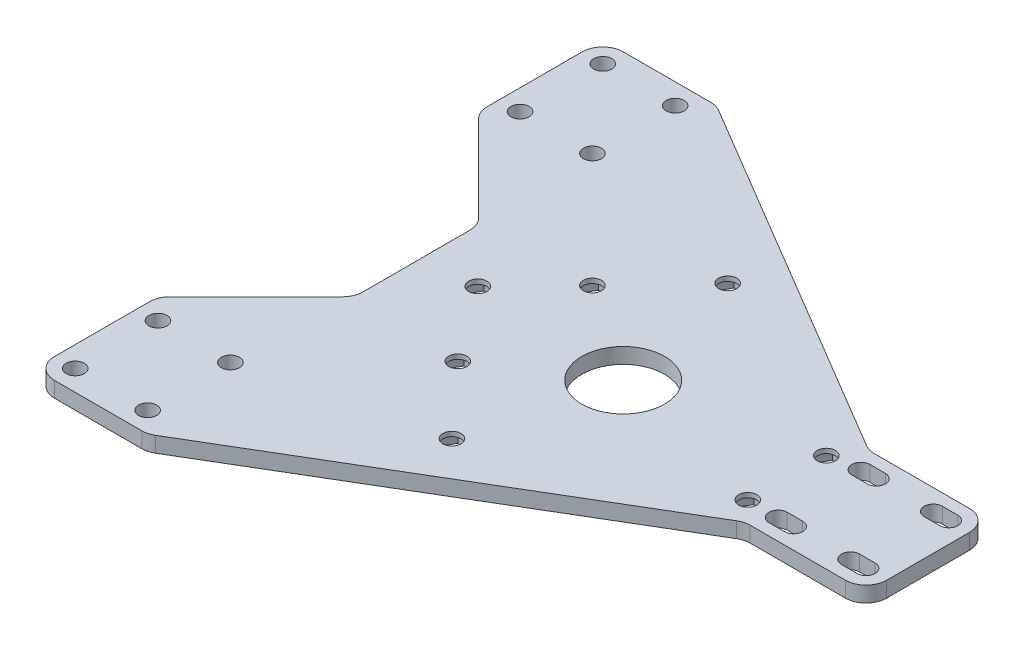
from build123d import *

# Parameters (mm, degrees)
ESQUISSE1_W             = 117.9
ESQUISSE1_H             = 110
BOSS_EXTRU_1_DEPTH      = 3
ESQUISSE2_R             = 1.75
ENL_V_MAT_EXTRU_1_DEPTH = 81.679009042
CONG_1_R                = 4
ESQUISSE3_R             = 8
ENL_V_MAT_EXTRU_2_DEPTH = 81.679009042
ENL_V_MAT_EXTRU_3_DEPTH = 2.1
ESQUISSE19_R            = 1.75
ENL_V_MAT_EXTRU_4_DEPTH = 81.679009042


with BuildPart() as part:
    # Esquisse1 → Boss.-Extru.1 (new body)
    with BuildSketch(Plane(origin=(0, 0, 0), x_dir=(1, 0, 0), z_dir=(0, 1, 0))):
        Rectangle(ESQUISSE1_W, ESQUISSE1_H)
    extrude(amount=BOSS_EXTRU_1_DEPTH)

    # Esquisse2 → Enlèv. mat.-Extru.1 (cut, through all)
    with BuildSketch(Plane(origin=(0, 0, 0), x_dir=(1, 0, 0), z_dir=(0, 1, 0))):
        with Locations(Location((-40.95, -35, 0), (0, 0, 270))):
            Circle(ESQUISSE2_R)
        with Locations(Location((-54.95, -35, 0), (0, 0, 270))):
            Circle(ESQUISSE2_R)
        with Locations(Location((-54.95, -51, 0), (0, 0, 270))):
            Circle(ESQUISSE2_R)
        with Locations(Location((-40.95, -51, 0), (0, 0, 270))):
            Circle(ESQUISSE2_R)
        with Locations(Location((-40.95, 51, 0), (0, 0, 90))):
            Circle(ESQUISSE2_R)
        with Locations(Location((-54.95, 51, 0), (0, 0, 90))):
            Circle(ESQUISSE2_R)
        with Locations(Location((-54.95, 35, 0), (0, 0, 90))):
            Circle(ESQUISSE2_R)
        with Locations(Location((-40.95, 35, 0), (0, 0, 90))):
            Circle(ESQUISSE2_R)
        Polygon((58.95, 12), (35.45, 12), (-36.95, 55), (58.95, 55), align=None)
        Polygon((58.95, -12), (35.45, -12), (-36.95, -55), (58.95, -55), align=None)
        Polygon((-58.95, -31), (-39.95, -12), (-39.95, 12), (-58.95, 31), align=None)
        with BuildLine():
            Line((37.95, 9.75), (40.95, 9.75))
            ThreePointArc((40.95, 9.75), (42.7, 8), (40.95, 6.25))
            Line((40.95, 6.25), (37.95, 6.25))
            ThreePointArc((37.95, 6.25), (36.2, 8), (37.95, 9.75))
        make_face()
        with BuildLine():
            Line((54.95, 6.25), (51.95, 6.25))
            ThreePointArc((51.95, 6.25), (50.2, 8), (51.95, 9.75))
            Line((51.95, 9.75), (54.95, 9.75))
            ThreePointArc((54.95, 9.75), (56.7, 8), (54.95, 6.25))
        make_face()
        with BuildLine():
            Line((37.95, -6.25), (40.95, -6.25))
            ThreePointArc((40.95, -6.25), (42.7, -8), (40.95, -9.75))
            Line((40.95, -9.75), (37.95, -9.75))
            ThreePointArc((37.95, -9.75), (36.2, -8), (37.95, -6.25))
        make_face()
        with BuildLine():
            Line((54.95, -9.75), (51.95, -9.75))
            ThreePointArc((51.95, -9.75), (50.2, -8), (51.95, -6.25))
            Line((51.95, -6.25), (54.95, -6.25))
            ThreePointArc((54.95, -6.25), (56.7, -8), (54.95, -9.75))
        make_face()
    extrude(amount=ENL_V_MAT_EXTRU_1_DEPTH, mode=Mode.SUBTRACT)

    # Congé1
    cong_1_edges = [part.edges().sort_by_distance(p)[0] for p in [
        (-39.95, 1.5, -12),
        (-58.95, 1.5, -55),
        (-58.95, 1.5, 55),
        (58.95, 1.5, 12),
        (35.45, 1.5, 12),
        (-36.95, 1.5, 55),
        (58.95, 1.5, -12),
        (-36.95, 1.5, -55),
        (35.45, 1.5, -12),
        (-58.95, 1.5, -31),
        (-58.95, 1.5, 31),
        (-39.95, 1.5, 12),
    ]]
    fillet(cong_1_edges, radius=CONG_1_R)

    # Esquisse3 → Enlèv. mat.-Extru.2 (cut, through all)
    with BuildSketch(Plane(origin=(0, 0, 0), x_dir=(1, 0, 0), z_dir=(0, 1, 0))):
        with Locations(Location((0, 0, 0), (0, 0, 270))):
            Circle(ESQUISSE3_R)
    extrude(amount=ENL_V_MAT_EXTRU_2_DEPTH, mode=Mode.SUBTRACT)

    # Esquisse6 → Enlèv. mat.-Extru.3 (cut)
    with BuildSketch(Plane.XZ):
        Polygon((-15.609293528, -12.883492858), (-17.225874282, -10.083492858), (-20.45903579, -10.083492858), (-22.075616543, -12.883492858), (-20.45903579, -15.683492858), (-17.225874282, -15.683492858), align=None)
        Polygon((-26.54852785, -1.667626755), (-28.165108604, 1.132373245), (-31.398270112, 1.132373245), (-33.014850865, -1.667626755), (-31.398270112, -4.467626755), (-28.165108604, -4.467626755), align=None)
        Polygon((-15.926426125, 12.814550393), (-17.543006878, 15.614550393), (-20.776168386, 15.614550393), (-22.39274914, 12.814550393), (-20.776168386, 10.014550393), (-17.543006878, 10.014550393), align=None)
        Polygon((-3.541855014, 26.331929262), (-5.158435767, 29.131929262), (-8.391597275, 29.131929262), (-10.008178029, 26.331929262), (-8.391597275, 23.531929262), (-5.158435767, 23.531929262), align=None)
        Polygon((35.306333009, 7.982986542), (33.689752255, 10.782986542), (30.456590748, 10.782986542), (28.840009994, 7.982986542), (30.456590748, 5.182986542), (33.689752255, 5.182986542), align=None)
        Polygon((35.491429855, -7.015871386), (33.874849101, -4.215871386), (30.641687594, -4.215871386), (29.02510684, -7.015871386), (30.641687594, -9.815871386), (33.874849101, -9.815871386), align=None)
        Polygon((-2.892117597, -26.317910049), (-4.508698351, -23.517910049), (-7.741859858, -23.517910049), (-9.358440612, -26.317910049), (-7.741859858, -29.117910049), (-4.508698351, -29.117910049), align=None)
    extrude(amount=-ENL_V_MAT_EXTRU_3_DEPTH, mode=Mode.SUBTRACT)

    # Esquisse19 → Enlèv. mat.-Extru.4 (cut, through all)
    with BuildSketch(Plane.XZ):
        with Locations(Location((-29.781689358, -1.667626755, 0), (0, 0, 270))):
            Circle(ESQUISSE19_R)
        with Locations(Location((-19.159587632, 12.814550393, 0), (0, 0, 270))):
            Circle(ESQUISSE19_R)
        with Locations(Location((-6.775016521, 26.331929262, 0), (0, 0, 270))):
            Circle(ESQUISSE19_R)
        with Locations(Location((-18.842455036, -12.883492858, 0), (0, 0, 270))):
            Circle(ESQUISSE19_R)
        with Locations(Location((-6.125279104, -26.317910049, 0), (0, 0, 270))):
            Circle(ESQUISSE19_R)
        with Locations(Location((32.258268348, -7.015871386, 0), (0, 0, 270))):
            Circle(ESQUISSE19_R)
        with Locations(Location((32.073171502, 7.982986542, 0), (0, 0, 270))):
            Circle(ESQUISSE19_R)
    extrude(amount=-ENL_V_MAT_EXTRU_4_DEPTH, mode=Mode.SUBTRACT)


solid = part.part
